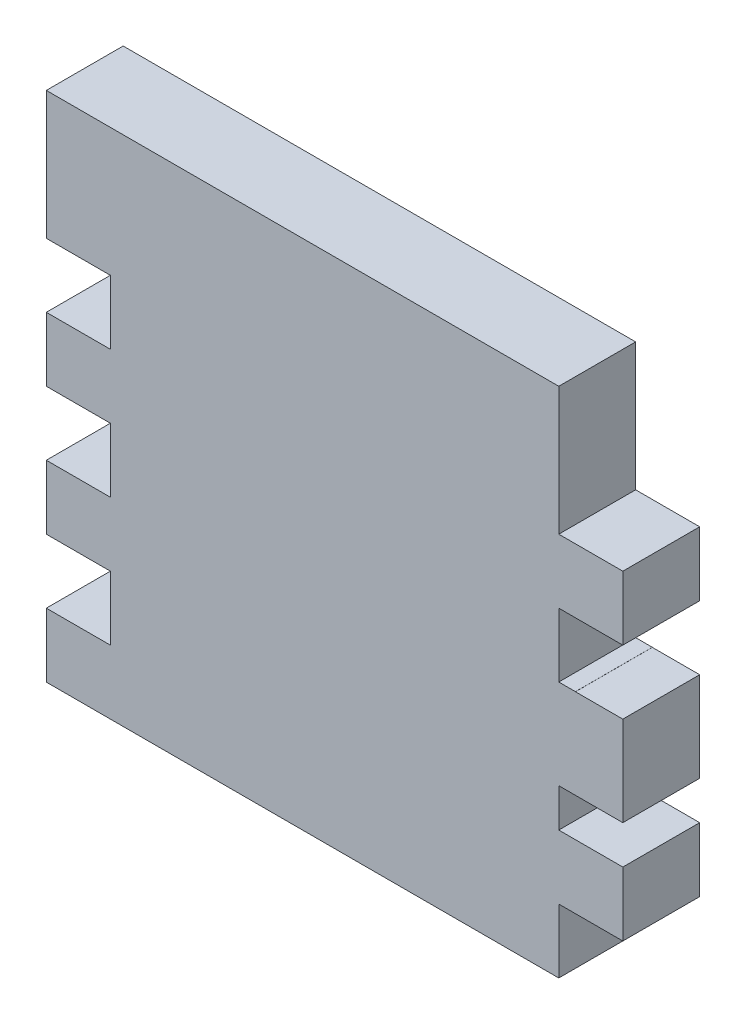
from build123d import *

# Parameters (mm, degrees)
SKETCH1_W           = 45
SKETCH1_H           = 40
BOSS_EXTRUDE1_DEPTH = 6
SKETCH2_W           = 5
SKETCH2_H           = 5
SKETCH2_W_2         = 3.698246201
SKETCH2_H_2         = 10
SKETCH2_H_3         = 3
CUT_EXTRUDE1_DEPTH  = 6
SKETCH3_W           = 5
SKETCH3_H           = 5
CUT_EXTRUDE2_DEPTH  = 6
SKETCH4_W           = 5
SKETCH4_H           = 4.992810735
SKETCH4_H_2         = 10
SKETCH4_H_3         = 3
CUT_EXTRUDE3_DEPTH  = 6


with BuildPart() as part:
    # Sketch1 → Boss-Extrude1 (new body)
    with BuildSketch(Plane.XY):
        with Locations((8.087316256, -14.086161404)):
            Rectangle(SKETCH1_W, SKETCH1_H)
    extrude(amount=BOSS_EXTRUDE1_DEPTH)

    # Sketch2 → Cut-Extrude1 (cut)
    with BuildSketch(Plane.XY.offset(6)):
        with Locations((-11.912683744, -6.586161404)):
            Rectangle(SKETCH2_W, SKETCH2_H)
        with Locations((-11.912683744, -16.586161404)):
            Rectangle(SKETCH2_W, SKETCH2_H)
        with Locations((-11.912683744, -26.586161404)):
            Rectangle(SKETCH2_W, SKETCH2_H)
        with Locations((28.738193155, 0.913838596)):
            Rectangle(SKETCH2_W_2, SKETCH2_H_2)
        with Locations((28.738193155, -11.586161404)):
            Rectangle(SKETCH2_W_2, SKETCH2_H)
        with Locations((28.738193155, -22.586161404)):
            Rectangle(SKETCH2_W_2, SKETCH2_H_3)
    extrude(amount=-CUT_EXTRUDE1_DEPTH, mode=Mode.SUBTRACT)

    # Sketch3 → Cut-Extrude2 (cut)
    with BuildSketch(Plane.XY.offset(6)):
        with Locations((28.087316256, -31.586161404)):
            Rectangle(SKETCH3_W, SKETCH3_H)
    extrude(amount=-CUT_EXTRUDE2_DEPTH, mode=Mode.SUBTRACT)

    # Sketch4 → Cut-Extrude3 (cut)
    with BuildSketch(Plane.XY.offset(6)):
        with Locations((28.087316256, -11.582566772)):
            Rectangle(SKETCH4_W, SKETCH4_H)
        with Locations((28.087316256, 0.913838596)):
            Rectangle(SKETCH4_W, SKETCH4_H_2)
        with Locations((28.087316256, -22.586161404)):
            Rectangle(SKETCH4_W, SKETCH4_H_3)
    extrude(amount=-CUT_EXTRUDE3_DEPTH, mode=Mode.SUBTRACT)


solid = part.part
